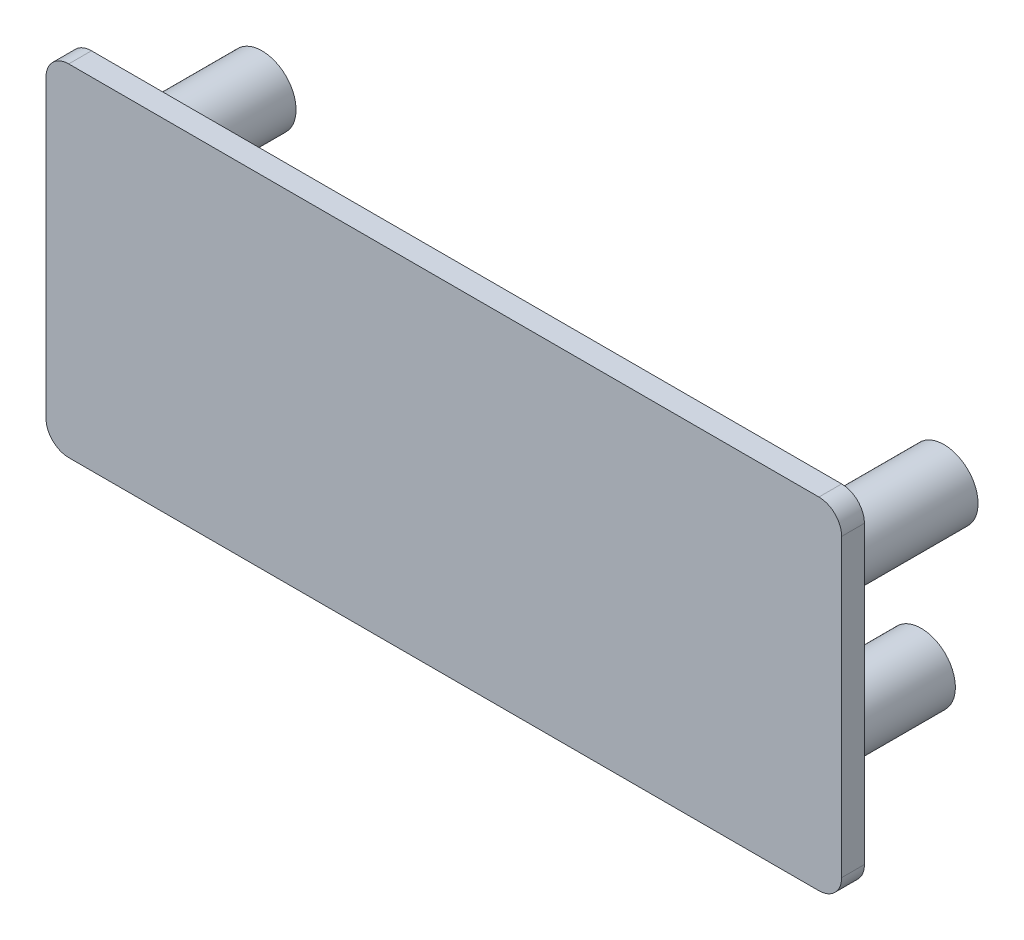
from build123d import *

# Parameters (mm, degrees)
BOSS_EXTRUDE1_DEPTH = 2
SKETCH2_R           = 3
SKETCH2_R_2         = 1.95
BOSS_EXTRUDE2_DEPTH = 12


with BuildPart() as part:
    # Sketch1 → Boss-Extrude1 (new body)
    with BuildSketch(Plane.XY):
        with BuildLine():
            Line((-33, -15), (33, -15))
            ThreePointArc((33, -15), (34.414213562, -14.414213562), (35, -13))
            Line((35, -13), (35, 13))
            ThreePointArc((35, 13), (34.414213562, 14.414213562), (33, 15))
            Line((33, 15), (-33, 15))
            ThreePointArc((-33, 15), (-34.414213562, 14.414213562), (-35, 13))
            Line((-35, 13), (-35, -13))
            ThreePointArc((-35, -13), (-34.414213562, -14.414213562), (-33, -15))
        make_face()
    extrude(amount=BOSS_EXTRUDE1_DEPTH)

    # Sketch2 → Boss-Extrude2 (add)
    # profile 1 of 4: a face of its own
    with BuildSketch(Plane(origin=(0, 0, 0), x_dir=(-1, 0, 0), z_dir=(0, 0, -1))):
        with Locations((28, -7.5)):
            Circle(SKETCH2_R)
        with Locations((28, -7.5)):
            Circle(SKETCH2_R_2, mode=Mode.SUBTRACT)
    # profile 2 of 4: a face of its own
    with BuildSketch(Plane(origin=(0, 0, 0), x_dir=(-1, 0, 0), z_dir=(0, 0, -1))):
        with Locations((30, 7.5)):
            Circle(SKETCH2_R)
        with Locations((30, 7.5)):
            Circle(SKETCH2_R_2, mode=Mode.SUBTRACT)
    # profile 3 of 4: a face of its own
    with BuildSketch(Plane(origin=(0, 0, 0), x_dir=(-1, 0, 0), z_dir=(0, 0, -1))):
        with Locations((-30, 7.5)):
            Circle(SKETCH2_R)
        with Locations((-30, 7.5)):
            Circle(SKETCH2_R_2, mode=Mode.SUBTRACT)
    # profile 4 of 4: a face of its own
    with BuildSketch(Plane(origin=(0, 0, 0), x_dir=(-1, 0, 0), z_dir=(0, 0, -1))):
        with Locations((-28, -7.5)):
            Circle(SKETCH2_R)
        with Locations((-28, -7.5)):
            Circle(SKETCH2_R_2, mode=Mode.SUBTRACT)
    extrude(amount=BOSS_EXTRUDE2_DEPTH)


solid = part.part
